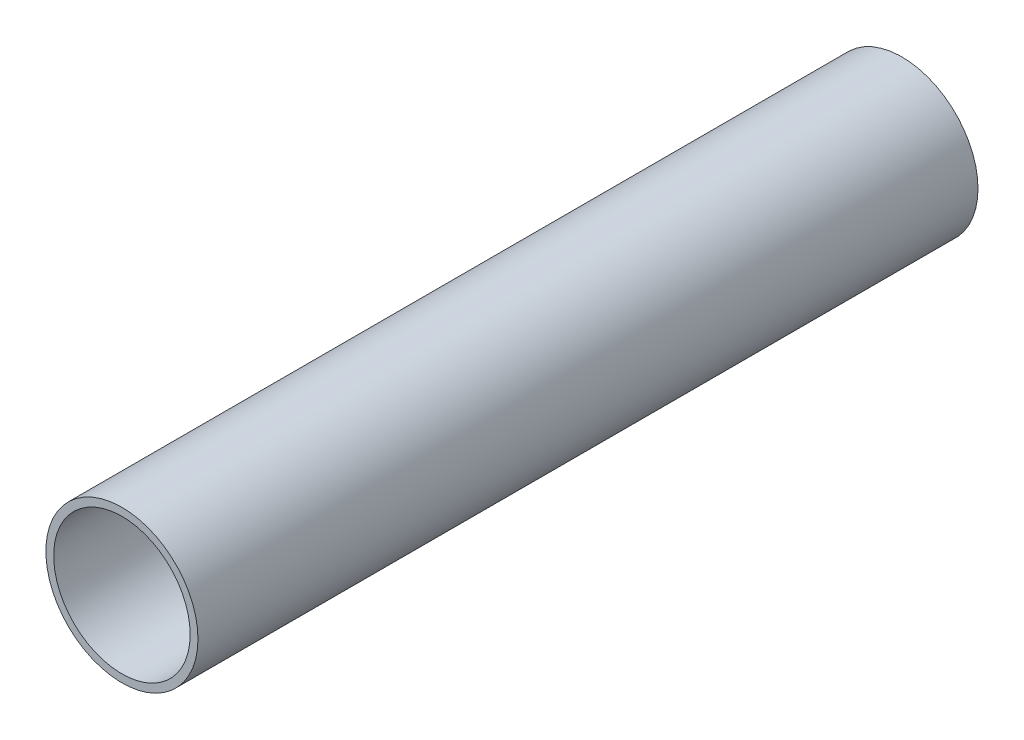
from build123d import *

# Parameters (mm, degrees)
SKETCH1_R           = 1.95
SKETCH1_R_2         = 1.75
BOSS_EXTRUDE1_DEPTH = 20


with BuildPart() as part:
    # Sketch1 → Boss-Extrude1 (new body)
    with BuildSketch(Plane.XY):
        Circle(SKETCH1_R)
        Circle(SKETCH1_R_2, mode=Mode.SUBTRACT)
    extrude(amount=BOSS_EXTRUDE1_DEPTH)


solid = part.part
